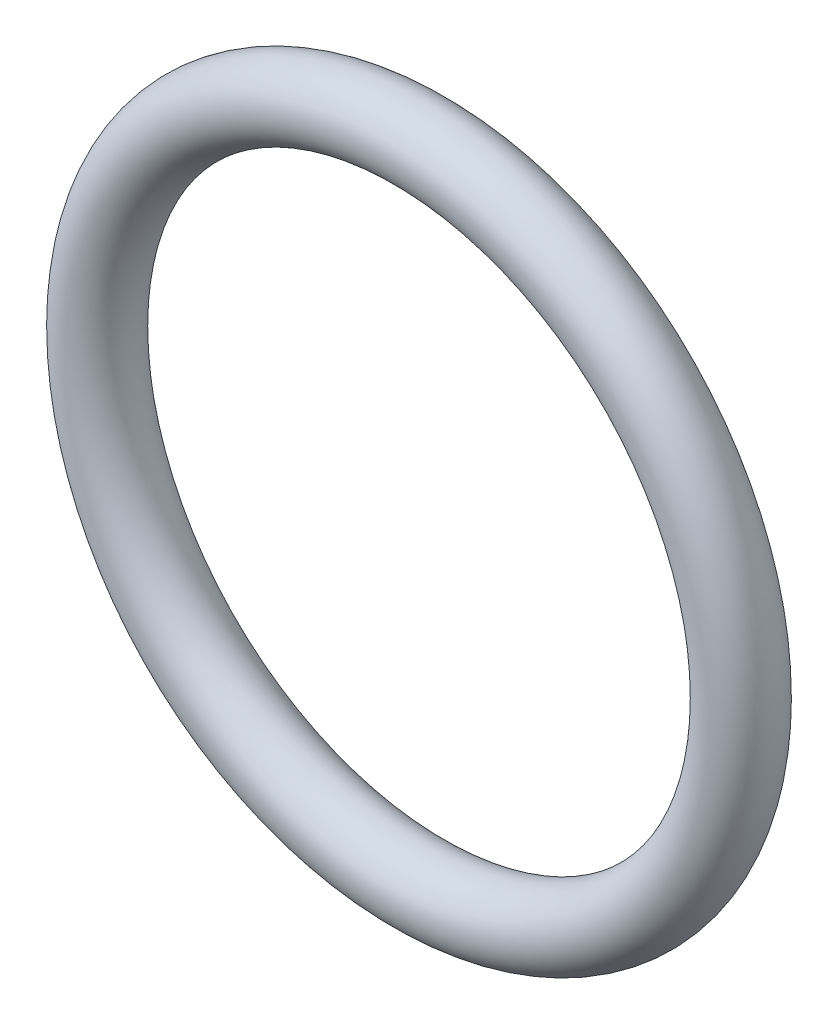
from build123d import *

# Parameters (mm, degrees)
SKETCH2_R = 0.75


with BuildPart() as part:
    # Sketch2 → Revolve1 (revolve)
    with BuildSketch(Plane(origin=(0, 0, 0), x_dir=(1, 0, 0), z_dir=(0, 1, 0)), mode=Mode.PRIVATE) as revolve1_sk:
        with Locations((6.75, 0)):
            Circle(SKETCH2_R)
    revolve(revolve1_sk.sketch.rotate(Axis((0, 0, -0.75), (0, 0, 1)), 180), axis=Axis((0, 0, -0.75), (0, 0, 1)))


solid = part.part
